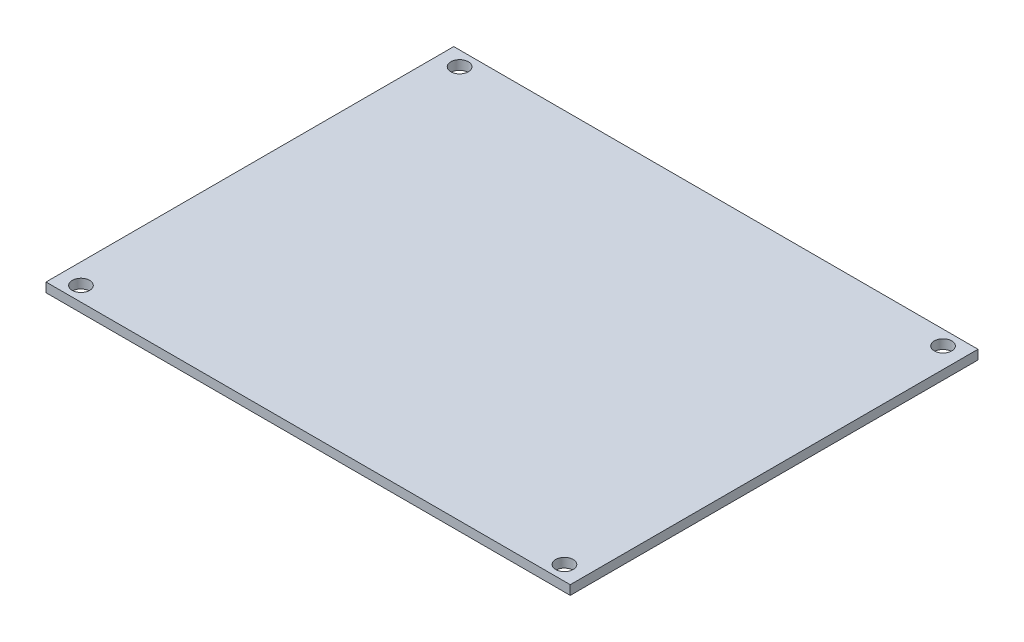
from build123d import *

# Parameters (mm, degrees)
SKETCH1_W           = 90
SKETCH1_H           = 70
BOSS_EXTRUDE1_DEPTH = 1.6
SKETCH2_R           = 1.5
CUT_EXTRUDE1_DEPTH  = 1.6


with BuildPart() as part:
    # Sketch1 → Boss-Extrude1 (new body)
    with BuildSketch(Plane(origin=(0, 0, 0), x_dir=(1, 0, 0), z_dir=(0, 1, 0))):
        Rectangle(SKETCH1_W, SKETCH1_H)
    extrude(amount=BOSS_EXTRUDE1_DEPTH)

    # Sketch2 → Cut-Extrude1 (cut)
    with BuildSketch(Plane(origin=(0, 1.6, 0), x_dir=(1, 0, 0), z_dir=(0, 1, 0))):
        with Locations(Location((-41.5, 32.5, 0), (0, 0, 270))):
            Circle(SKETCH2_R)
        with Locations(Location((41.5, 32.5, 0), (0, 0, 270))):
            Circle(SKETCH2_R)
        with Locations(Location((41.5, -32.5, 0), (0, 0, 270))):
            Circle(SKETCH2_R)
        with Locations(Location((-41.5, -32.5, 0), (0, 0, 270))):
            Circle(SKETCH2_R)
    extrude(amount=-CUT_EXTRUDE1_DEPTH, mode=Mode.SUBTRACT)


solid = part.part
